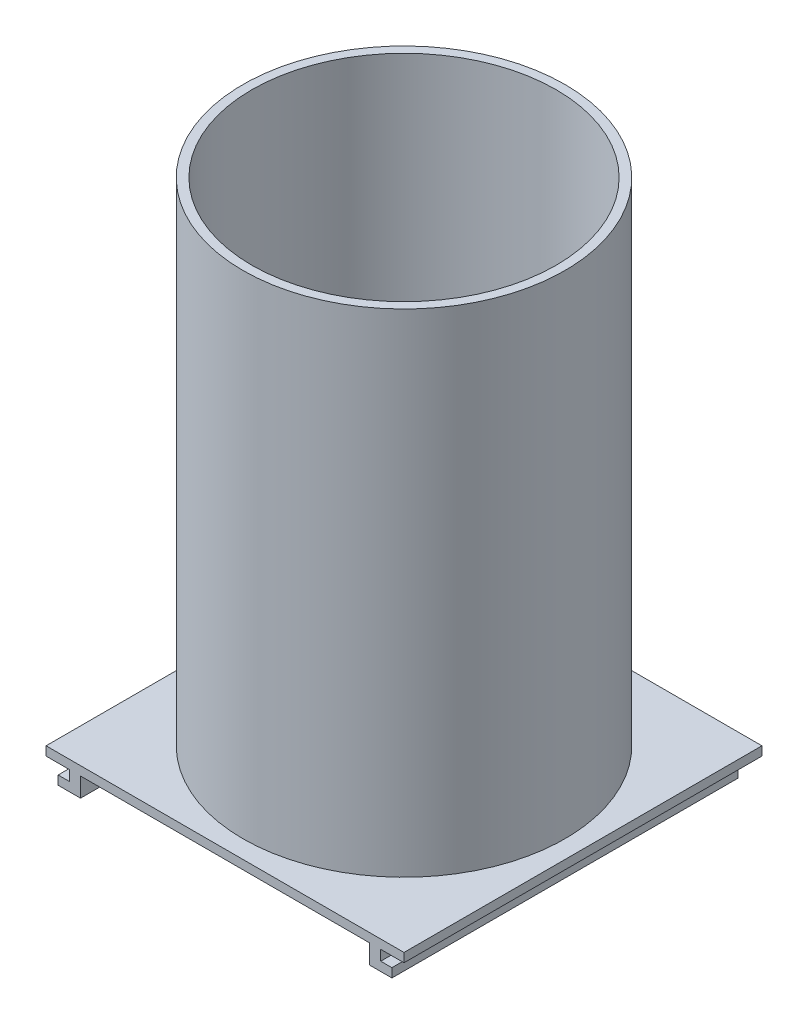
from build123d import *

# Parameters (mm, degrees)
SKETCH1_W           = 80
SKETCH1_H           = 80
SKETCH1_R           = 36
SKETCH1_R_2         = 34
BOSS_EXTRUDE3_DEPTH = 2
BOSS_EXTRUDE4_START = 110
SKETCH1_7_R         = 36
SKETCH1_7_R_2       = 34
BOSS_EXTRUDE4_DEPTH = 110
BOSS_EXTRUDE5_DEPTH = 77.35


with BuildPart() as part:
    # Sketch1 → Boss-Extrude3 (new body)
    # profile 1 of 2: a face of its own
    with BuildSketch(Plane(origin=(0, 0, 0), x_dir=(1, 0, 0), z_dir=(0, 1, 0))):
        Rectangle(SKETCH1_W, SKETCH1_H)
        Circle(SKETCH1_R, mode=Mode.SUBTRACT)
    # profile 2 of 2: a face of its own
    with BuildSketch(Plane(origin=(0, 0, 0), x_dir=(1, 0, 0), z_dir=(0, 1, 0))):
        Circle(SKETCH1_R)
        with Locations(Location((0, 0, 0), (0, 0, 270))):
            Circle(SKETCH1_R_2, mode=Mode.SUBTRACT)
    extrude(amount=-BOSS_EXTRUDE3_DEPTH)

    # Sketch1<7> → Boss-Extrude4 (add)
    with BuildSketch(Plane(origin=(0, 0, 0), x_dir=(1, 0, 0), z_dir=(0, 1, 0)).offset(BOSS_EXTRUDE4_START)):
        with Locations(Location((0, 0, 0), (0, 0, 270))):
            Circle(SKETCH1_7_R)
        with Locations(Location((0, 0, 0), (0, 0, 270))):
            Circle(SKETCH1_7_R_2, mode=Mode.SUBTRACT)
    extrude(amount=-BOSS_EXTRUDE4_DEPTH)

    # Sketch3 → Boss-Extrude5 (add)
    with BuildSketch(Plane.XY.offset(40)):
        Polygon((-32.3, -2), (-34.8, -2), (-34.8, -4.3), (-37.3, -4.3), (-37.3, -6.3), (-32.3, -6.3), align=None)
        Polygon((32.3, -6.3), (37.3, -6.3), (37.3, -4.3), (34.8, -4.3), (34.8, -2), (32.3, -2), align=None)
    extrude(amount=-BOSS_EXTRUDE5_DEPTH)


solid = part.part
